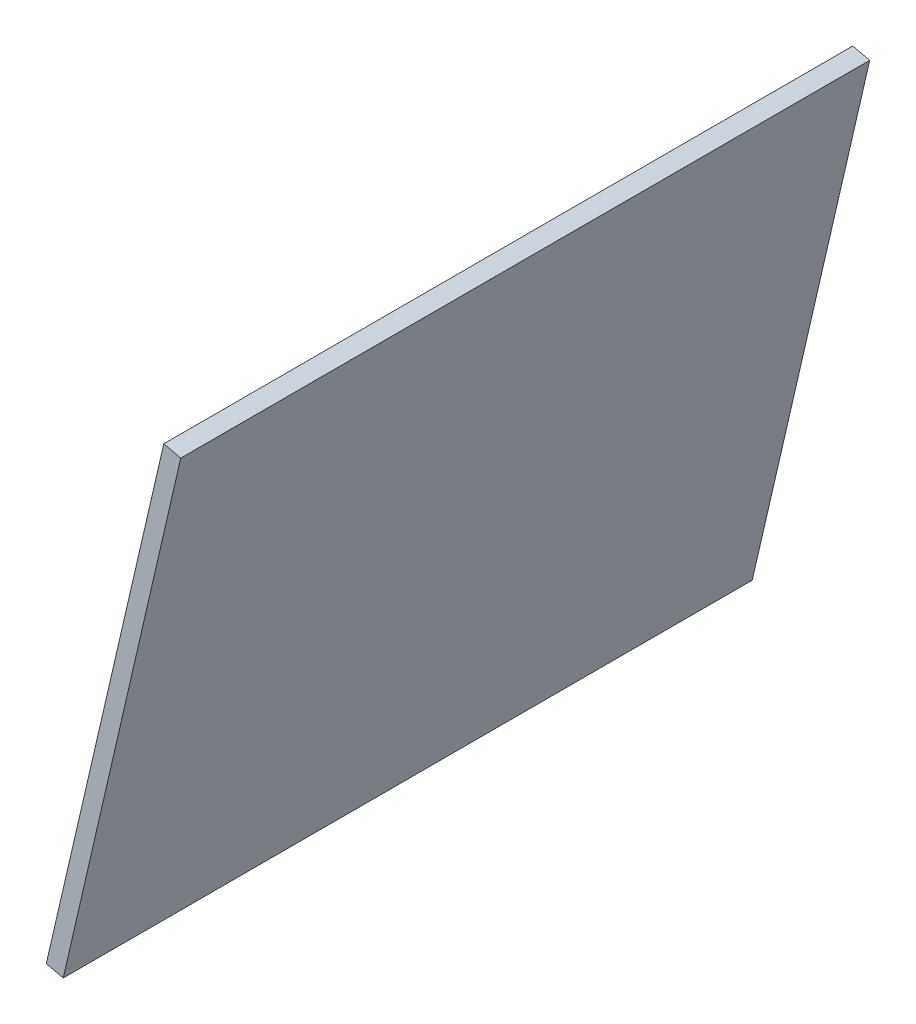
from build123d import *

# Parameters (mm, degrees)
BOSS_EXTRUDE1_DEPTH = 402


with BuildPart() as part:
    # Sketch1 → Boss-Extrude1 (new body)
    with BuildSketch(Plane.XY):
        Polygon((174.207835311, 1829.307995747), (105.642753947, 1532.32), (95.743154089, 1534.605502712), (164.308235453, 1831.593498459), align=None)
    extrude(amount=BOSS_EXTRUDE1_DEPTH)


solid = part.part
